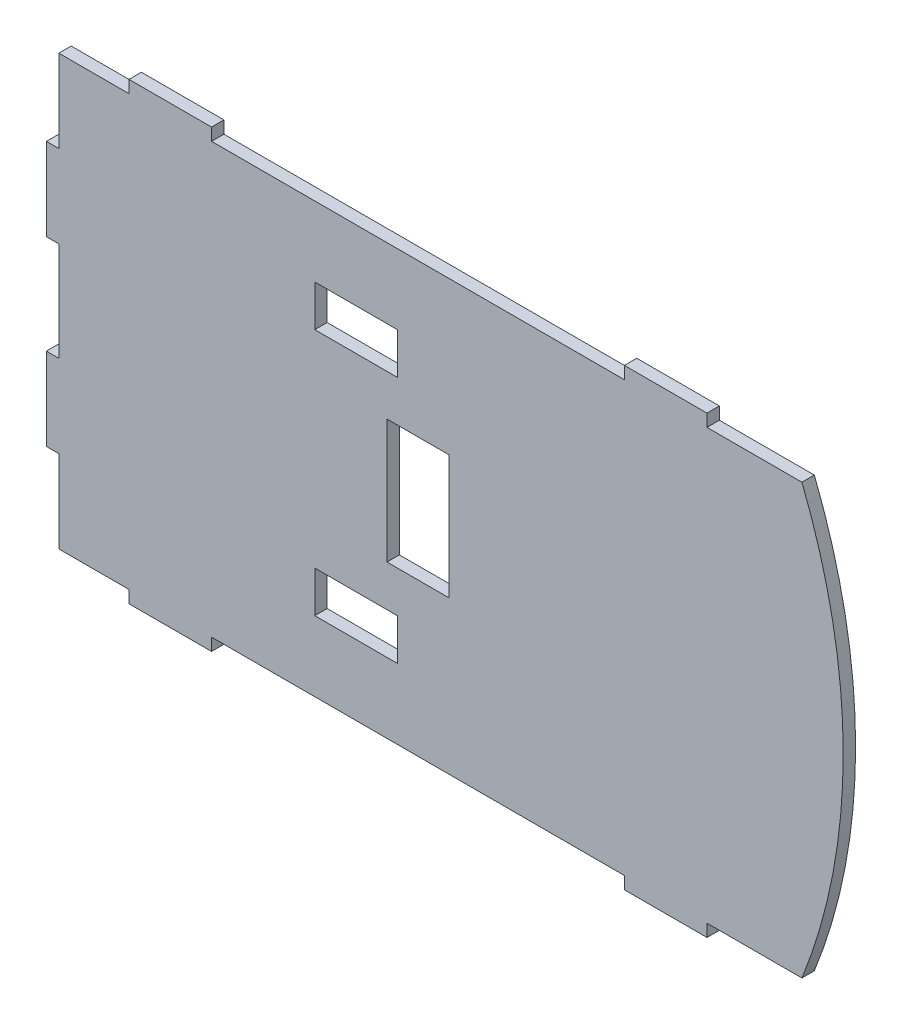
from build123d import *

# Parameters (mm, degrees)
SKETCH1_W           = 15
SKETCH1_H           = 30
SKETCH1_W_2         = 20
SKETCH1_H_2         = 10
BOSS_EXTRUDE1_DEPTH = 3


with BuildPart() as part:
    # Sketch1 → Boss-Extrude1 (new body)
    with BuildSketch(Plane.XY):
        with BuildLine():
            Line((-50, 52), (-50, 55))
            Line((-50, 55), (-70, 55))
            Line((-70, 55), (-70, 52))
            Line((-70, 52), (-87, 52))
            Line((-87, 52), (-87, 32))
            Line((-87, 32), (-90, 32))
            Line((-90, 32), (-90, 12))
            Line((-90, 12), (-87, 12))
            Line((-87, 12), (-87, -12))
            Line((-87, -12), (-90, -12))
            Line((-90, -12), (-90, -32))
            Line((-90, -32), (-87, -32))
            Line((-87, -32), (-87, -52))
            Line((-87, -52), (-70, -52))
            Line((-70, -52), (-70, -55))
            Line((-70, -55), (-50, -55))
            Line((-50, -55), (-50, -52))
            Line((-50, -52), (50, -52))
            Line((50, -52), (50, -55))
            Line((50, -55), (70, -55))
            Line((70, -55), (70, -52))
            Line((70, -52), (90, -52))
            Line((90, -52), (93, -52))
            ThreePointArc((93, -52), (103, 0), (93, 52))
            Line((93, 52), (90, 52))
            Line((90, 52), (70, 52))
            Line((70, 52), (70, 55))
            Line((70, 55), (50, 55))
            Line((50, 55), (50, 52))
            Line((50, 52), (-50, 52))
        make_face()
        Rectangle(SKETCH1_W, SKETCH1_H, mode=Mode.SUBTRACT)
        with Locations((-15, 30)):
            Rectangle(SKETCH1_W_2, SKETCH1_H_2, mode=Mode.SUBTRACT)
        with Locations((-15, -30)):
            Rectangle(SKETCH1_W_2, SKETCH1_H_2, mode=Mode.SUBTRACT)
    extrude(amount=BOSS_EXTRUDE1_DEPTH)


solid = part.part
